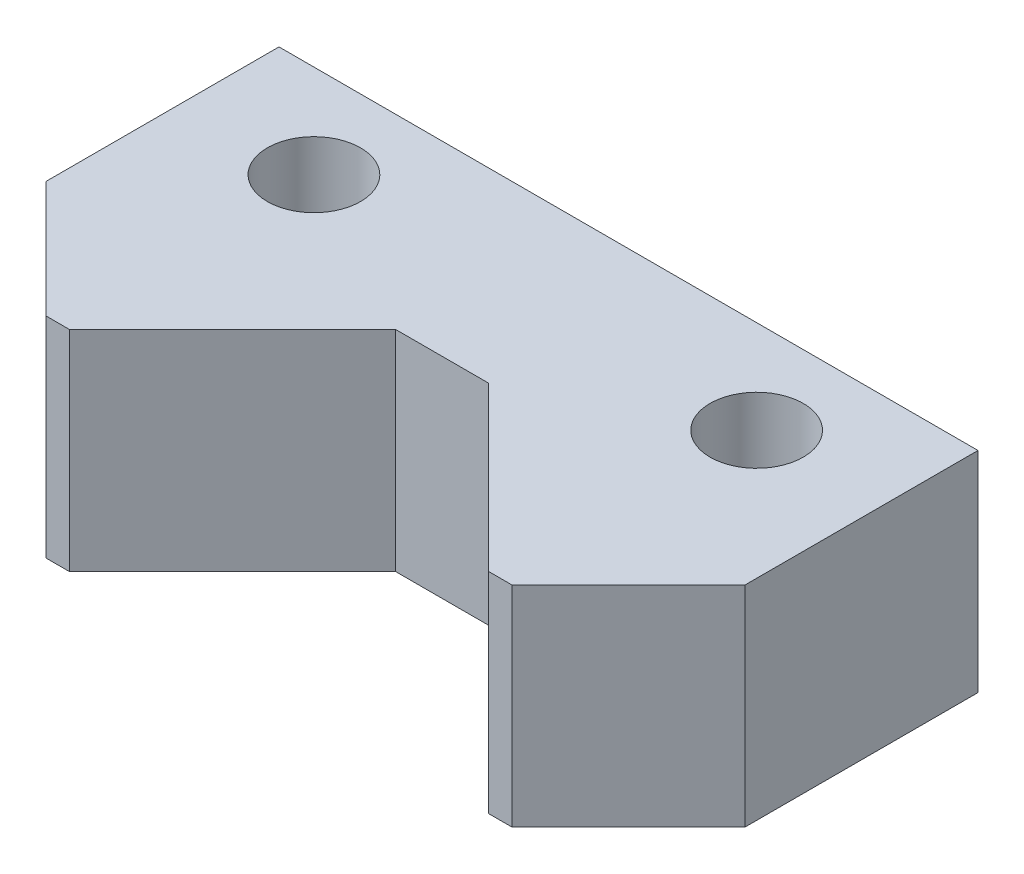
from build123d import *

# Parameters (mm, degrees)
ESTRUSIONE_ESTRUSIONE1_DEPTH = 9
FORO_8_0_8_1_D               = 8


with BuildPart() as part:
    # Schizzo1 → Estrusione-Estrusione1 (new, symmetric)
    with BuildSketch(Plane(origin=(0, 0, 0), x_dir=(1, 0, 0), z_dir=(0, 1, 0))):
        Polygon((30, 16), (-30, 16), (-30, -4), (-20, -14), (-18, -14), (-4, 0), (4, 0), (18, -14), (20, -14), (30, -4), align=None)
    extrude(amount=ESTRUSIONE_ESTRUSIONE1_DEPTH, both=True)

    # Foro Ø8.0 (8)-1 (through all)
    with Locations(Plane(origin=(0, 9, 0), x_dir=(1, 0, 0), z_dir=(0, 1, 0))):
        with Locations((19, 8), (-19, 8)):
            Hole(FORO_8_0_8_1_D / 2)


solid = part.part
